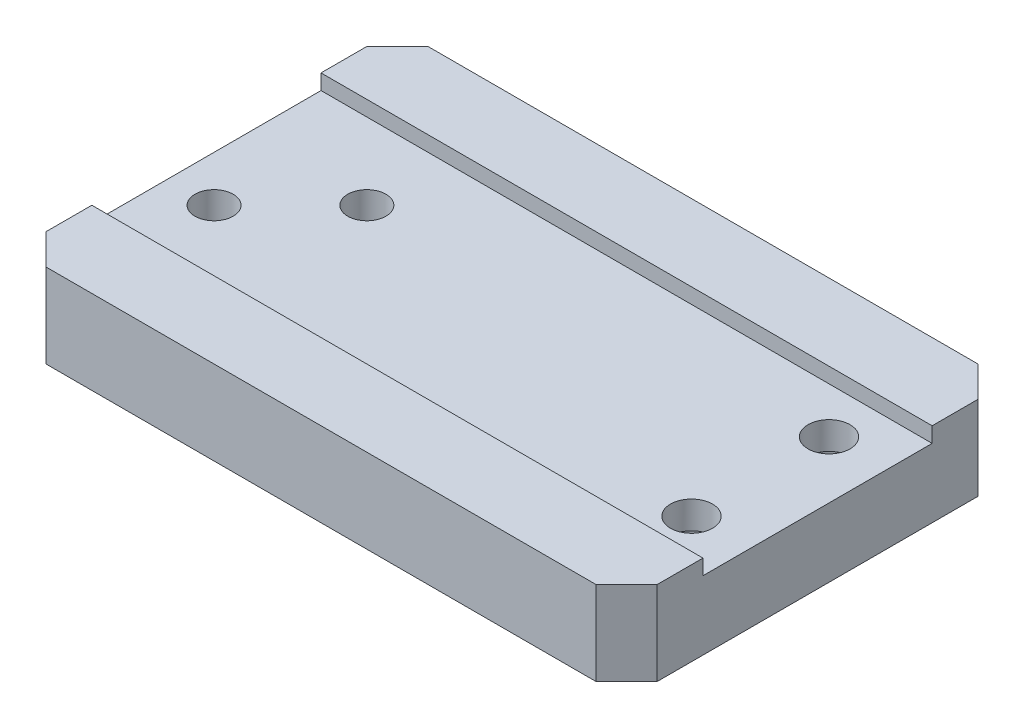
from build123d import *

# Parameters (mm, degrees)
RESSALTO_EXTRUS_O1_DEPTH = 11
ESBO_O2_W                = 80
ESBO_O2_H                = 30
CORTE_EXTRUS_O1_DEPTH    = 2
ESBO_O4_R                = 2.5
CORTE_EXTRUS_O2_DEPTH    = 85.297093663
ESBO_O5_R                = 2.75
CORTE_EXTRUS_O3_DEPTH    = 85.297093663
CHANFRO2_SIZE            = 4
ESBO_O7_R                = 4.75
CORTE_EXTRUS_O6_DEPTH    = 5.4


with BuildPart() as part:
    # Esboço1 → Ressalto-extrusão1 (new body)
    with BuildSketch(Plane(origin=(0, 0, 0), x_dir=(1, 0, 0), z_dir=(0, 1, 0))):
        Polygon((0, 0), (0, -25), (80, -25), (80, 25), (0, 25), align=None)
    extrude(amount=RESSALTO_EXTRUS_O1_DEPTH)

    # Esboço2 → Corte-extrusão1 (cut)
    with BuildSketch(Plane(origin=(0, 11, 0), x_dir=(1, 0, 0), z_dir=(0, 1, 0))):
        with Locations((40, 0)):
            Rectangle(ESBO_O2_W, ESBO_O2_H)
    extrude(amount=-CORTE_EXTRUS_O1_DEPTH, mode=Mode.SUBTRACT)

    # Esboço4 → Corte-extrusão2 (cut, through all)
    with BuildSketch(Plane(origin=(0, 9, 0), x_dir=(1, 0, 0), z_dir=(0, 1, 0))):
        with Locations(Location((16, 5, 0), (0, 0, 270))):
            Circle(ESBO_O4_R)
        with Locations(Location((6, -5, 0), (0, 0, 270))):
            Circle(ESBO_O4_R)
    extrude(amount=-CORTE_EXTRUS_O2_DEPTH, mode=Mode.SUBTRACT)

    # Esboço5 → Corte-extrusão3 (cut, through all)
    with BuildSketch(Plane(origin=(0, 9, 0), x_dir=(1, 0, 0), z_dir=(0, 1, 0))):
        with Locations(Location((72.5, 9, 0), (0, 0, 270))):
            Circle(ESBO_O5_R)
        with Locations(Location((72.5, -9, 0), (0, 0, 270))):
            Circle(ESBO_O5_R)
    extrude(amount=-CORTE_EXTRUS_O3_DEPTH, mode=Mode.SUBTRACT)

    # Chanfro2
    chanfro2_edges = [part.edges().sort_by_distance(p)[0] for p in [
        (0, 5.5, -25),
        (80, 5.5, -25),
        (80, 5.5, 25),
        (0, 5.5, 25),
    ]]
    chamfer(chanfro2_edges, length=CHANFRO2_SIZE)

    # Esboço7 → Corte-extrusão6 (cut)
    with BuildSketch(Plane.XZ):
        with Locations(Location((72.5, 9, 0), (0, 0, 270))):
            Circle(ESBO_O7_R)
        with Locations(Location((72.5, -9, 0), (0, 0, 270))):
            Circle(ESBO_O7_R)
    extrude(amount=-CORTE_EXTRUS_O6_DEPTH, mode=Mode.SUBTRACT)


solid = part.part
